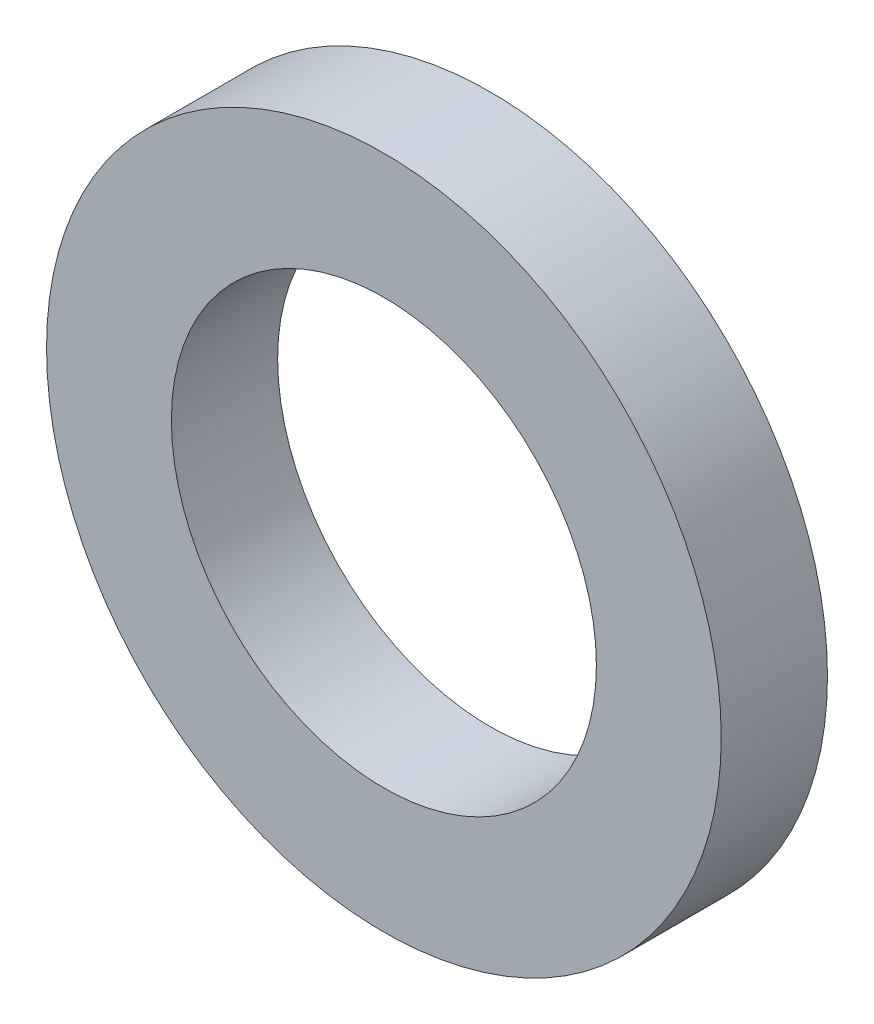
from build123d import *

# Parameters (mm, degrees)
SKETCH1_R           = 6.35
SKETCH1_R_2         = 4
BOSS_EXTRUDE1_DEPTH = 2


with BuildPart() as part:
    # Sketch1 → Boss-Extrude1 (new body)
    with BuildSketch(Plane(origin=(0, 0, 0), x_dir=(0, 1, 0), z_dir=(0, 0, 1))):
        with Locations(Location((0, 0, 0), (0, 0, 270))):
            Circle(SKETCH1_R)
        with Locations(Location((0, 0, 0), (0, 0, 270))):
            Circle(SKETCH1_R_2, mode=Mode.SUBTRACT)
    extrude(amount=BOSS_EXTRUDE1_DEPTH)


solid = part.part
